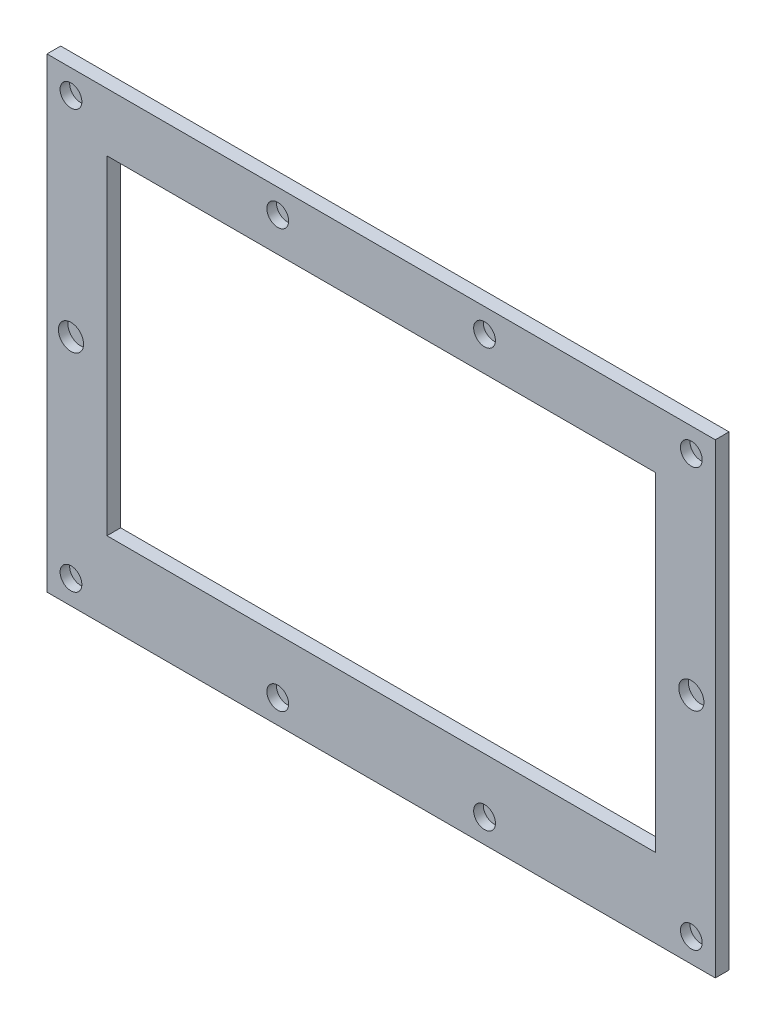
from build123d import *

# Parameters (mm, degrees)
SKETCH1_W           = 195
SKETCH1_H           = 136
SKETCH1_W_2         = 160
SKETCH1_H_2         = 96
BOSS_EXTRUDE1_DEPTH = 2
SKETCH1_3_W         = 195
SKETCH1_3_H         = 136
SKETCH1_3_W_2       = 160
SKETCH1_3_H_2       = 96
BOSS_EXTRUDE2_DEPTH = 2
SKETCH2_R           = 3.175
SKETCH2_R_2         = 3.673722566
CUT_EXTRUDE1_DEPTH  = 2.794


with BuildPart() as part:
    # Sketch1 → Boss-Extrude1 (new body)
    with BuildSketch(Plane.XY):
        Rectangle(SKETCH1_W, SKETCH1_H)
        with Locations((0, 3)):
            Rectangle(SKETCH1_W_2, SKETCH1_H_2, mode=Mode.SUBTRACT)
    extrude(amount=-BOSS_EXTRUDE1_DEPTH)

    # Sketch1<3> → Boss-Extrude2 (add)
    with BuildSketch(Plane.XY):
        Rectangle(SKETCH1_3_W, SKETCH1_3_H)
        with Locations((0, 3)):
            Rectangle(SKETCH1_3_W_2, SKETCH1_3_H_2, mode=Mode.SUBTRACT)
    extrude(amount=BOSS_EXTRUDE2_DEPTH)

    # Sketch2 → Cut-Extrude1 (cut)
    with BuildSketch(Plane.XY.offset(2)):
        with Locations((-90.5, 61)):
            Circle(SKETCH2_R)
        with Locations((90.5, 61)):
            Circle(SKETCH2_R)
        with Locations((90.5, -61)):
            Circle(SKETCH2_R)
        with Locations((-90.5, -61)):
            Circle(SKETCH2_R)
        with Locations((-30.166666667, -61)):
            Circle(SKETCH2_R)
        with Locations((30.166666667, -61)):
            Circle(SKETCH2_R)
        with Locations((90.5, 0)):
            Circle(SKETCH2_R_2)
        with Locations((-30.166666667, 61)):
            Circle(SKETCH2_R)
        with Locations((30.166666667, 61)):
            Circle(SKETCH2_R)
        with Locations((-90.5, 0)):
            Circle(SKETCH2_R_2)
    extrude(amount=-CUT_EXTRUDE1_DEPTH, mode=Mode.SUBTRACT)


solid = part.part
